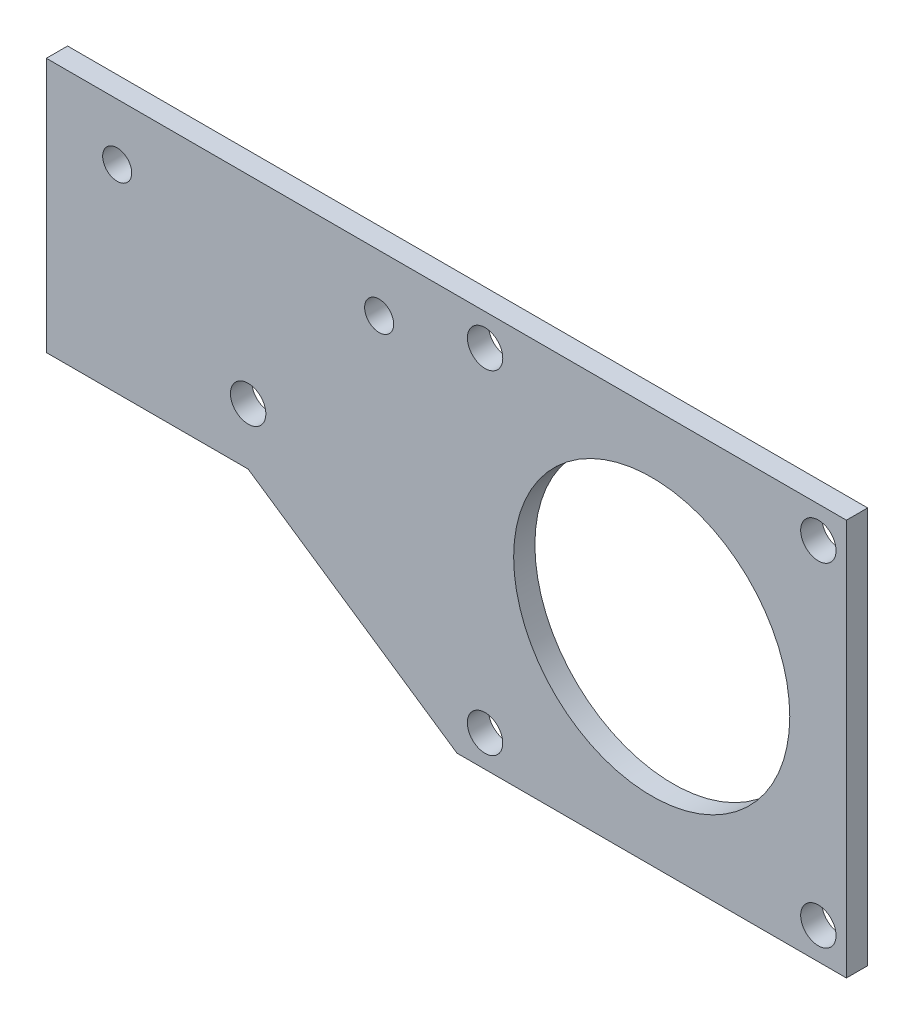
from build123d import *

# Parameters (mm, degrees)
SKETCH1_W           = 113
SKETCH1_H           = 56
SKETCH1_R           = 2.5
BOSS_EXTRUDE1_DEPTH = 3
CUT_EXTRUDE1_DEPTH  = 3
SKETCH3_R           = 2.05
CUT_EXTRUDE2_DEPTH  = 10
SKETCH5_R           = 19.5
SKETCH5_R_2         = 2.5
CUT_EXTRUDE4_DEPTH  = 10


with BuildPart() as part:
    # Sketch1 → Boss-Extrude1 (new body)
    with BuildSketch(Plane.XY):
        with Locations((56.5, 28)):
            Rectangle(SKETCH1_W, SKETCH1_H)
        with Locations((28.5, 28)):
            Circle(SKETCH1_R, mode=Mode.SUBTRACT)
    extrude(amount=BOSS_EXTRUDE1_DEPTH)

    # Sketch2 → Cut-Extrude1 (cut)
    with BuildSketch(Plane.XY.offset(3)):
        Polygon((58, 0), (28.5, 20), (0, 20), (0, 28), (-30.035464335, 6.528850882), (11.479915888, -13.732243772), align=None)
    extrude(amount=-CUT_EXTRUDE1_DEPTH, mode=Mode.SUBTRACT)

    # Sketch3 → Cut-Extrude2 (cut)
    with BuildSketch(Plane(origin=(0, 0, 0), x_dir=(-1, 0, 0), z_dir=(0, 0, -1))):
        with Locations((-47.001204436, 47.999419281)):
            Circle(SKETCH3_R)
        with Locations((-10.001204503, 48.001647488)):
            Circle(SKETCH3_R)
    extrude(amount=-CUT_EXTRUDE2_DEPTH, mode=Mode.SUBTRACT)

    # Sketch5 → Cut-Extrude4 (cut)
    with BuildSketch(Plane.XY.offset(3)):
        with Locations((85.499999929, 27.997100776)):
            Circle(SKETCH5_R)
        with Locations((109.039999656, 51.534265429)):
            Circle(SKETCH5_R_2)
        with Locations((61.962835275, 51.537100503)):
            Circle(SKETCH5_R_2)
        with Locations((109.037164582, 4.457101048)):
            Circle(SKETCH5_R_2)
        with Locations((61.960000201, 4.459936122)):
            Circle(SKETCH5_R_2)
    extrude(amount=-CUT_EXTRUDE4_DEPTH, mode=Mode.SUBTRACT)


solid = part.part
